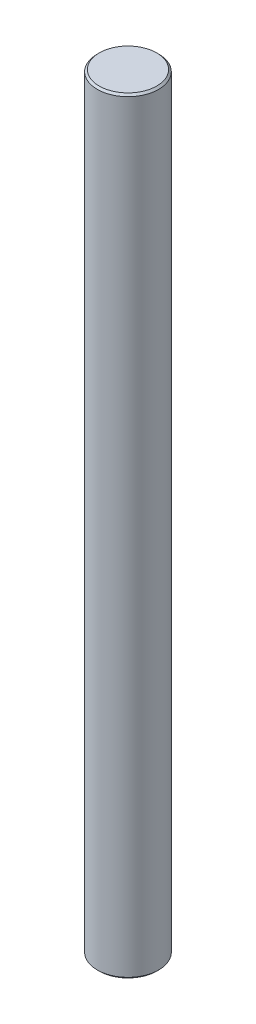
from build123d import *

# Parameters (mm, degrees)
SKETCH2_R           = 4
BOSS_EXTRUDE1_DEPTH = 100
CHAMFER1_SIZE       = 0.25


with BuildPart() as part:
    # Sketch2 → Boss-Extrude1 (new body)
    with BuildSketch(Plane(origin=(0, 0, 0), x_dir=(1, 0, 0), z_dir=(0, 1, 0))):
        with Locations(Location((0, 0, 0), (0, 0, 270))):
            Circle(SKETCH2_R)
    extrude(amount=BOSS_EXTRUDE1_DEPTH)

    # Chamfer1
    chamfer1_edges = [part.edges().sort_by_distance(p)[0] for p in [
        (0, 0, -4),
        (0, 100, -4),
    ]]
    chamfer(chamfer1_edges, length=CHAMFER1_SIZE)


solid = part.part
